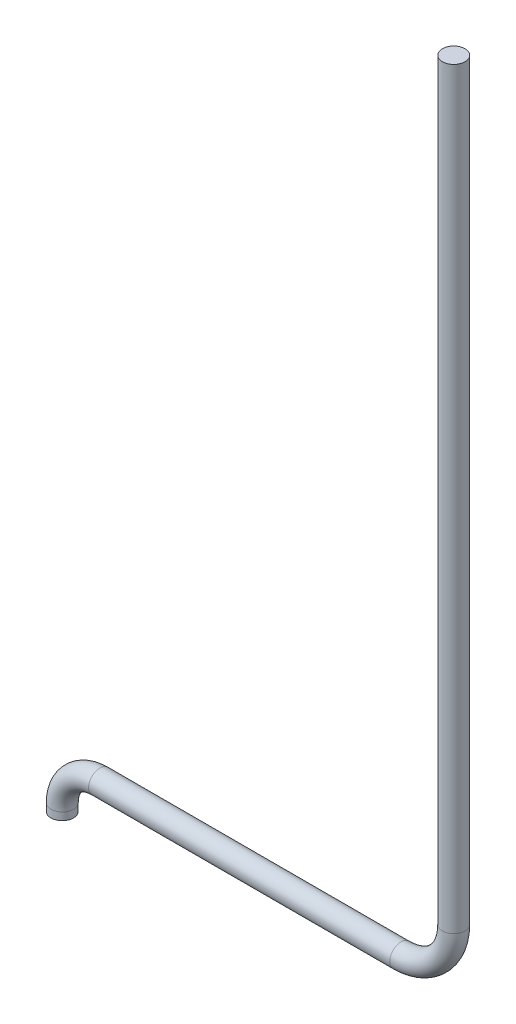
from build123d import *

# Parameters (mm, degrees)
SKETCH2_R = 15
SHELL1_T  = -5


with BuildPart() as part:
    # Sweep1: sweep along a path in Sketch1
    with BuildLine(Plane.XY) as sweep1_path:
        Line((0, 0), (0, 10))
        ThreePointArc((0, 10), (14.644660941, 45.355339059), (50, 60))
        Line((50, 60), (450, 60))
        ThreePointArc((450, 60), (499.497474683, 80.502525317), (520, 130))
        Line((520, 130), (520, 1130))
    # Sketch2 → Sweep1 (sweep)
    with BuildSketch(Plane(origin=(0, 0, 0), x_dir=(1, 0, 0), z_dir=(0, 1, 0))):
        Circle(SKETCH2_R)
    sweep(path=sweep1_path.line)

    # Shell1
    shell1_openings = [part.faces().sort_by_distance(p)[0] for p in [
        (0, 0, 0),
    ]]
    offset(amount=SHELL1_T, openings=shell1_openings, kind=Kind.INTERSECTION)


solid = part.part
